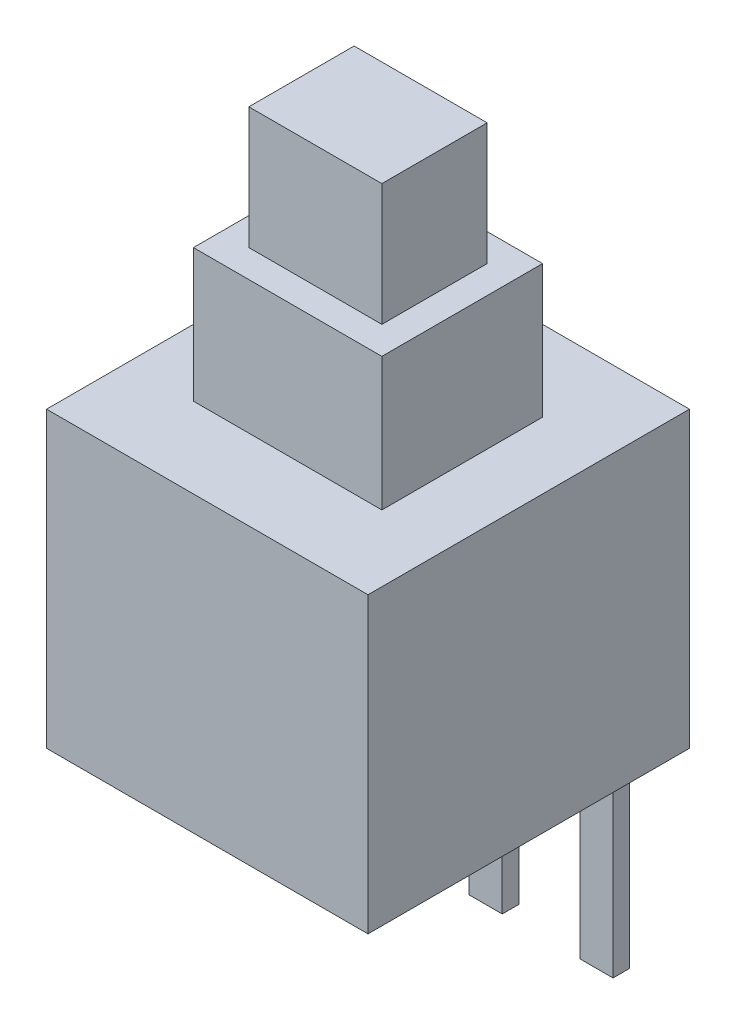
from build123d import *

# Parameters (mm, degrees)
ESQUISSE1_W        = 5.8
ESQUISSE1_H        = 5.8
BOSS_EXTRU_1_DEPTH = 5.3
ESQUISSE2_W        = 3.4
ESQUISSE2_H        = 2.9
BOSS_EXTRU_2_DEPTH = 2.4
ESQUISSE4_W        = 2.4
ESQUISSE4_H        = 1.9
BOSS_EXTRU_3_DEPTH = 2.2
ESQUISSE5_W        = 0.6
ESQUISSE5_H        = 0.3
BOSS_EXTRU_4_DEPTH = 3.5


with BuildPart() as part:
    # Esquisse1 → Boss.-Extru.1 (new body)
    with BuildSketch(Plane(origin=(0, 0, 0), x_dir=(1, 0, 0), z_dir=(0, 1, 0))):
        Rectangle(ESQUISSE1_W, ESQUISSE1_H)
    extrude(amount=BOSS_EXTRU_1_DEPTH)

    # Esquisse2 → Boss.-Extru.2 (add)
    with BuildSketch(Plane(origin=(0, 5.3, 0), x_dir=(1, 0, 0), z_dir=(0, 1, 0))):
        Rectangle(ESQUISSE2_W, ESQUISSE2_H)
    extrude(amount=BOSS_EXTRU_2_DEPTH)

    # Esquisse4 → Boss.-Extru.3 (add)
    with BuildSketch(Plane(origin=(0, 7.7, 0), x_dir=(1, 0, 0), z_dir=(0, 1, 0))):
        Rectangle(ESQUISSE4_W, ESQUISSE4_H)
    extrude(amount=BOSS_EXTRU_3_DEPTH)

    # Esquisse5 → Boss.-Extru.4 (add)
    with BuildSketch(Plane.XZ):
        with Locations((0, -2.271834071)):
            Rectangle(ESQUISSE5_W, ESQUISSE5_H)
        with Locations((-2, -2.271834071)):
            Rectangle(ESQUISSE5_W, ESQUISSE5_H)
        with Locations((2, -2.271834071)):
            Rectangle(ESQUISSE5_W, ESQUISSE5_H)
    extrude(amount=BOSS_EXTRU_4_DEPTH)


solid = part.part
